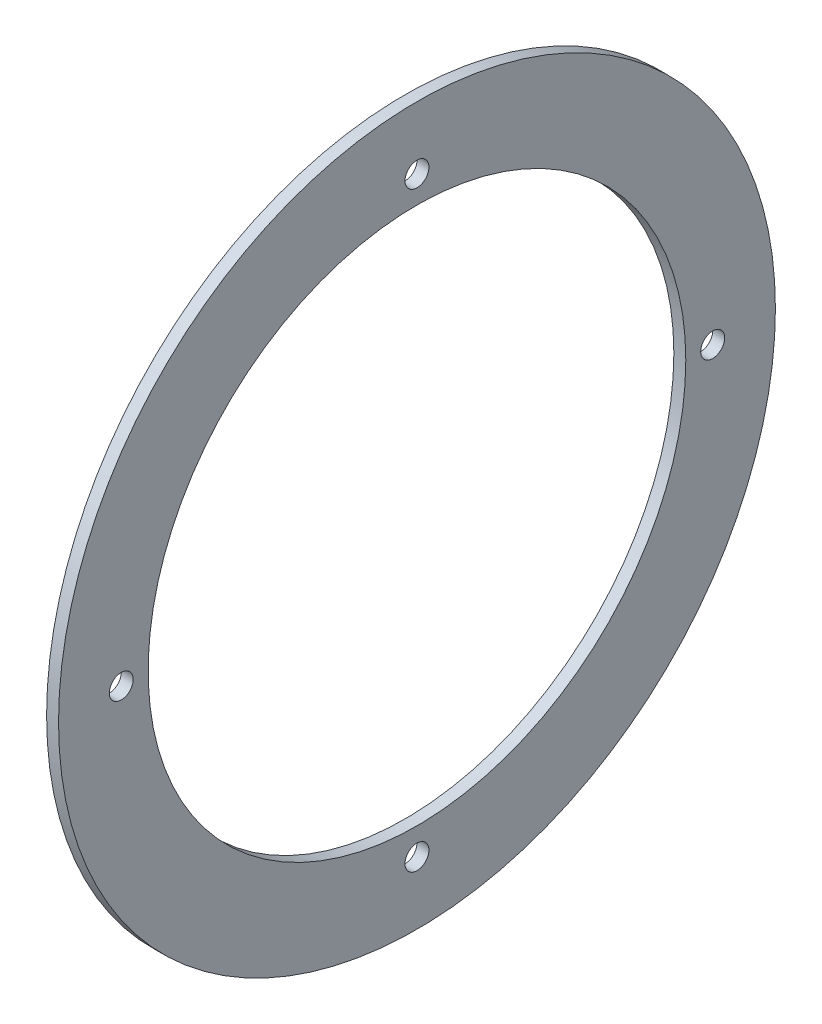
from build123d import *

# Parameters (mm, degrees)
SKETCH_1_R      = 60
SKETCH_1_R_2    = 45
SKETCH_1_R_3    = 2
EXTRUDE_1_DEPTH = 2


with BuildPart() as part:
    # 草图1 → 凸台-拉伸1 (new body)
    with BuildSketch(Plane(origin=(0, 0, 0), x_dir=(0, 0, -1), z_dir=(1, 0, 0))):
        Circle(SKETCH_1_R)
        Circle(SKETCH_1_R_2, mode=Mode.SUBTRACT)
        with Locations((0, 49.497474683)):
            Circle(SKETCH_1_R_3, mode=Mode.SUBTRACT)
        with Locations((-49.497474683, 0)):
            Circle(SKETCH_1_R_3, mode=Mode.SUBTRACT)
        with Locations((0, -49.497474683)):
            Circle(SKETCH_1_R_3, mode=Mode.SUBTRACT)
        with Locations((49.497474683, 0)):
            Circle(SKETCH_1_R_3, mode=Mode.SUBTRACT)
    extrude(amount=EXTRUDE_1_DEPTH)


solid = part.part
